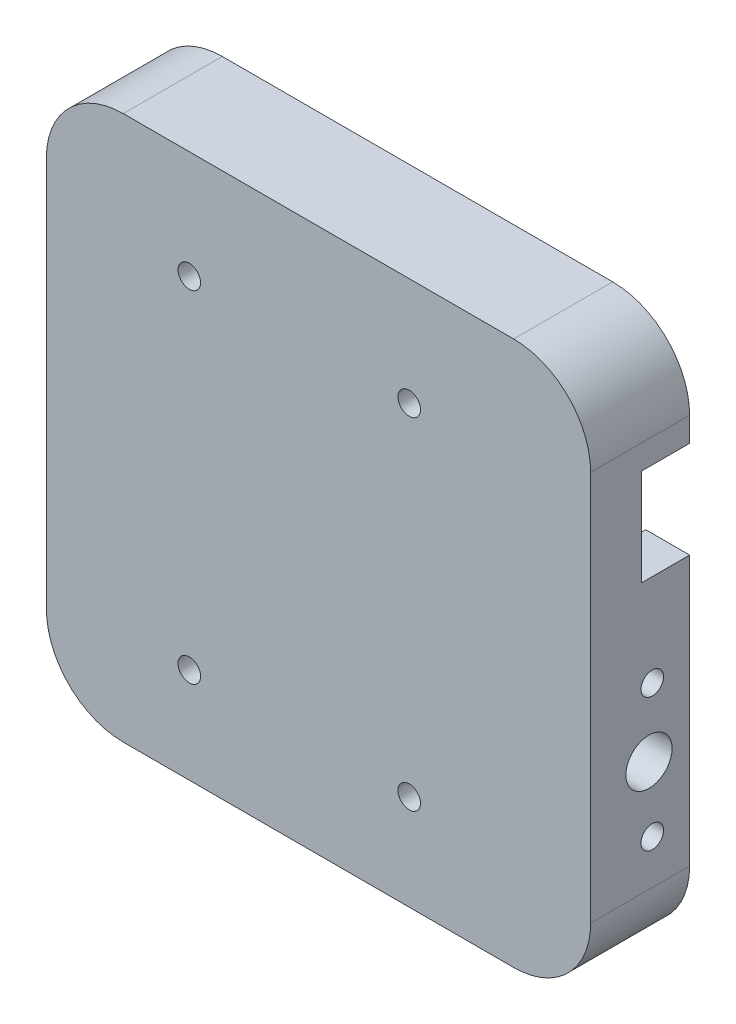
from build123d import *

# Parameters (mm, degrees)
EXTRUDE_1_DEPTH     = 3
EXTRUDE_START       = -6
EXTRUDE_2_DEPTH     = 6
SKETCH_2_R          = 2.1
CUT_EXTRUDE_1_DEPTH = 4
SKETCH_3_R          = 2.1
CUT_EXTRUDE_2_DEPTH = 4
M2_5X0_45_1_D       = 2.05
SKETCH_8_W          = 9.616
SKETCH_8_H          = 8.8
CUT_EXTRUDE_3_DEPTH = 4.4
M2_5X0_45_2_D       = 2.05


with BuildPart() as part:
    # 草图1 → 凸台-拉伸1 (new body)
    with BuildSketch(Plane.XY):
        with BuildLine():
            Line((-95.018, -34.687), (-59.518, -34.687))
            ThreePointArc((-59.518, -34.687), (-54.568252532, -36.737252532), (-52.518, -41.687))
            Line((-52.518, -41.687), (-52.518, -77.187))
            ThreePointArc((-52.518, -77.187), (-54.568252532, -82.136747468), (-59.518, -84.187))
            Line((-59.518, -84.187), (-95.018, -84.187))
            ThreePointArc((-95.018, -84.187), (-99.967747468, -82.136747468), (-102.018, -77.187))
            Line((-102.018, -77.187), (-102.018, -41.687))
            ThreePointArc((-102.018, -41.687), (-99.967747468, -36.737252532), (-95.018, -34.687))
        make_face()
    extrude(amount=EXTRUDE_1_DEPTH)

    # 草图1<3> → 凸台-拉伸2 (add)
    with BuildSketch(Plane.XY.offset(EXTRUDE_START)):
        with BuildLine():
            Line((-59.518, -34.687), (-95.018, -34.687))
            ThreePointArc((-95.018, -34.687), (-99.967747468, -36.737252532), (-102.018, -41.687))
            Line((-102.018, -41.687), (-102.018, -77.187))
            ThreePointArc((-102.018, -77.187), (-99.967747468, -82.136747468), (-95.018, -84.187))
            Line((-95.018, -84.187), (-59.518, -84.187))
            ThreePointArc((-59.518, -84.187), (-54.568252532, -82.136747468), (-52.518, -77.187))
            Line((-52.518, -77.187), (-52.518, -41.687))
            ThreePointArc((-52.518, -41.687), (-54.568252532, -36.737252532), (-59.518, -34.687))
        make_face()
        with BuildLine():
            Line((-61.517999092, -80.187), (-94.518000908, -80.187))
            Line((-94.518000908, -80.187), (-95.018, -80.187))
            ThreePointArc((-95.018, -80.187), (-97.139320344, -79.308320344), (-98.018, -77.187))
            Line((-98.018, -77.187), (-98.018, -41.687))
            ThreePointArc((-98.018, -41.687), (-97.139320344, -39.565679656), (-95.018, -38.687))
            Line((-95.018, -38.687), (-59.518, -38.687))
            ThreePointArc((-59.518, -38.687), (-57.396679656, -39.565679656), (-56.518, -41.687))
            Line((-56.518, -41.687), (-56.518, -77.187))
            ThreePointArc((-56.518, -77.187), (-57.396679656, -79.308320344), (-59.518, -80.187))
            Line((-59.518, -80.187), (-61.517999092, -80.187))
        make_face(mode=Mode.SUBTRACT)
    extrude(amount=EXTRUDE_2_DEPTH)

    # 草图2 → 切除-拉伸1 (cut)
    with BuildSketch(Plane.ZY.offset(102.018)):
        with Locations((-2.6, -67.128)):
            Circle(SKETCH_2_R)
    extrude(amount=-CUT_EXTRUDE_1_DEPTH, mode=Mode.SUBTRACT)

    # 草图3 → 切除-拉伸2 (cut)
    with BuildSketch(Plane(origin=(-52.518, 0, 0), x_dir=(0, 0, -1), z_dir=(1, 0, 0))):
        with Locations(Location((2.3, -67.128, 0), (0, 0, 90))):
            Circle(SKETCH_3_R)
    extrude(amount=-CUT_EXTRUDE_2_DEPTH, mode=Mode.SUBTRACT)

    # M2.5x0.45 螺纹孔1 (through all)
    with Locations(Plane.ZY.offset(102.018)):
        with Locations((-2.6, -61.078), (-2.6, -73.178)):
            Hole(M2_5X0_45_1_D / 2)

    # 草图8 → 切除-拉伸3 (cut)
    with BuildSketch(Plane(origin=(0, 0, -6), x_dir=(-1, 0, 0), z_dir=(0, 0, -1))):
        with Locations((57.326, -48.302)):
            Rectangle(SKETCH_8_W, SKETCH_8_H)
    extrude(amount=-CUT_EXTRUDE_3_DEPTH, mode=Mode.SUBTRACT)

    # M2.5x0.45 螺纹孔2 (through all)
    with Locations(Plane.XY.offset(3)):
        with Locations((-89.018, -44.497), (-69.018, -44.497), (-69.018, -75.497), (-89.018, -75.497)):
            Hole(M2_5X0_45_2_D / 2)


solid = part.part
